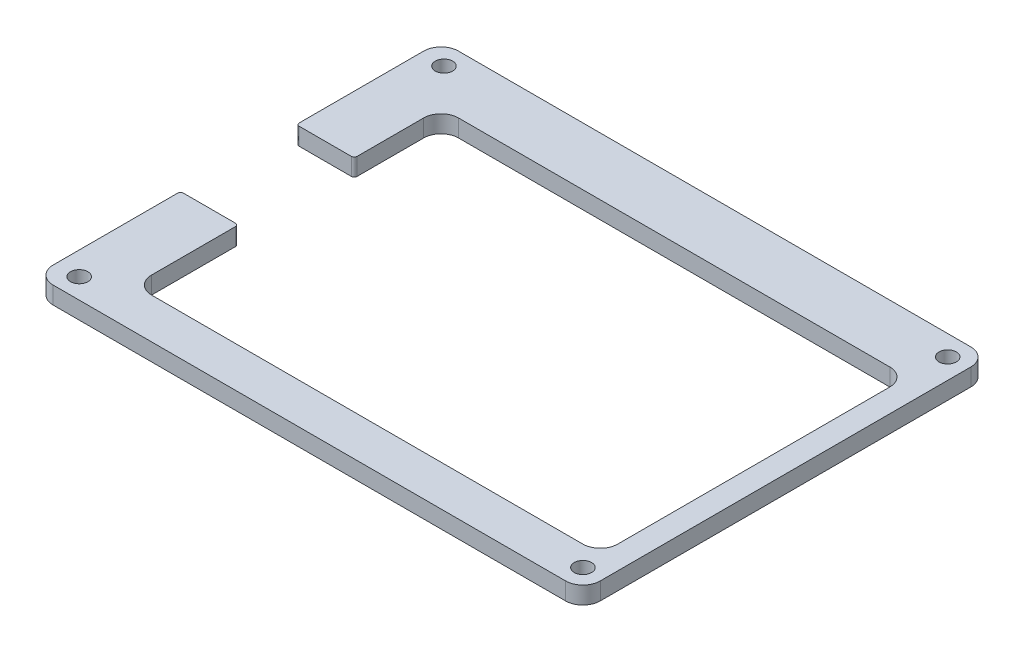
from build123d import *

# Parameters (mm, degrees)
SKETCH1_W           = 94.5
SKETCH1_H           = 70
BOSS_EXTRUDE1_DEPTH = 3
SKETCH3_R           = 1.5
CUT_EXTRUDE2_DEPTH  = 59.877521177
FILLET2_R           = 3
SKETCH5_W           = 10
SKETCH5_H           = 20
CUT_EXTRUDE3_DEPTH  = 59.877521177
FILLET3_R           = 3
FILLET4_R           = 0.5


with BuildPart() as part:
    # Sketch1 → Boss-Extrude1 (new body)
    with BuildSketch(Plane(origin=(0, 0, 0), x_dir=(1, 0, 0), z_dir=(0, 1, 0))):
        Rectangle(SKETCH1_W, SKETCH1_H)
    extrude(amount=BOSS_EXTRUDE1_DEPTH)

    # Sketch3 → Cut-Extrude2 (cut, through all)
    with BuildSketch(Plane(origin=(0, 3, 0), x_dir=(1, 0, 0), z_dir=(0, 1, 0))):
        with Locations(Location((43.75, 31.5, 0), (0, 0, 270))):
            Circle(SKETCH3_R)
        with Locations(Location((-43.25, 31.5, 0), (0, 0, 270))):
            Circle(SKETCH3_R)
        with Locations(Location((-43.25, -31.5, 0), (0, 0, 270))):
            Circle(SKETCH3_R)
        with Locations(Location((43.75, -31.5, 0), (0, 0, 270))):
            Circle(SKETCH3_R)
    extrude(amount=-CUT_EXTRUDE2_DEPTH, mode=Mode.SUBTRACT)

    # Fillet2
    fillet2_edges = [part.edges().sort_by_distance(p)[0] for p in [
        (47.25, 1.5, 35),
        (-47.25, 1.5, 35),
        (-47.25, 1.5, -35),
        (47.25, 1.5, -35),
    ]]
    fillet(fillet2_edges, radius=FILLET2_R)

    # Sketch5 → Cut-Extrude3 (cut, through all)
    with BuildSketch(Plane(origin=(0, 3, 0), x_dir=(1, 0, 0), z_dir=(0, 1, 0))):
        Polygon((-30, -28), (-37.25, -28), (-37.25, 25), (43.25, 25), (43.25, -28), align=None)
        with Locations((-42.25, 0)):
            Rectangle(SKETCH5_W, SKETCH5_H)
    extrude(amount=-CUT_EXTRUDE3_DEPTH, mode=Mode.SUBTRACT)

    # Fillet3
    fillet3_edges = [part.edges().sort_by_distance(p)[0] for p in [
        (43.25, 1.5, 28),
        (-37.25, 1.5, 28),
        (-37.25, 1.5, -25),
        (43.25, 1.5, -25),
    ]]
    fillet(fillet3_edges, radius=FILLET3_R)

    # Fillet4
    fillet4_edges = [part.edges().sort_by_distance(p)[0] for p in [
        (-37.25, 1.5, 10),
        (-47.25, 1.5, 10),
        (-47.25, 1.5, -10),
        (-37.25, 1.5, -10),
    ]]
    fillet(fillet4_edges, radius=FILLET4_R)


solid = part.part
